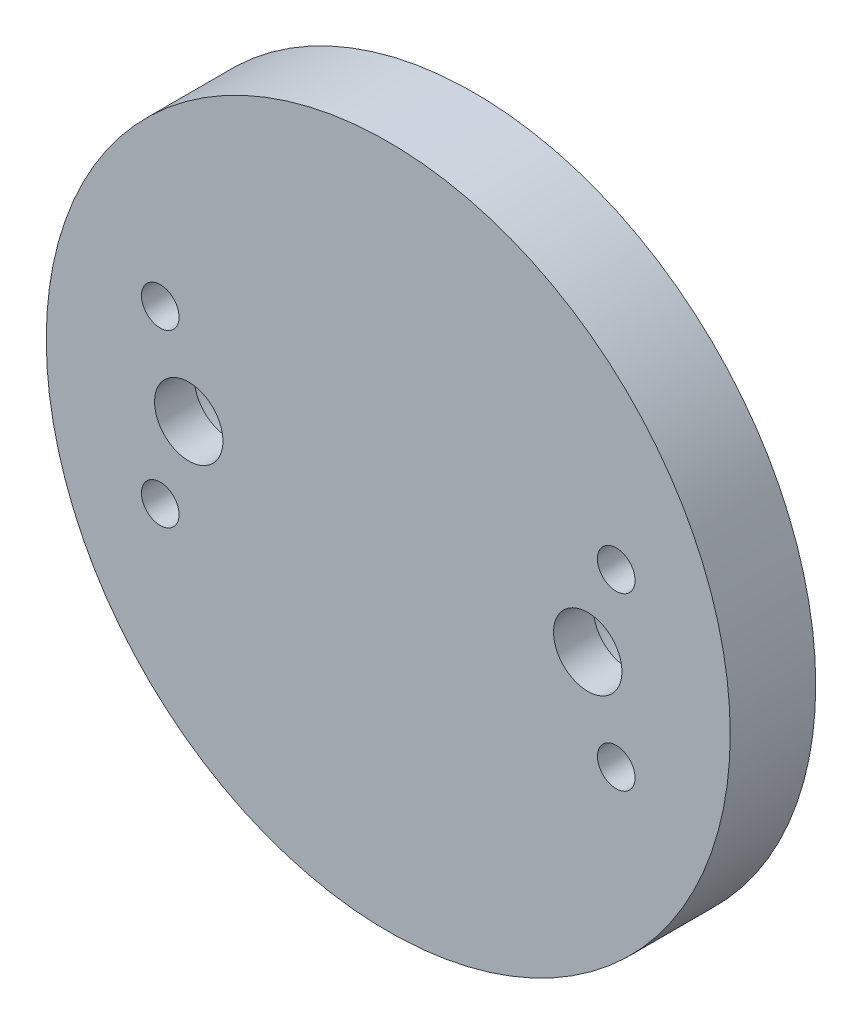
from build123d import *

# Parameters (mm, degrees)
SKETCH_1_R          = 60
EXTRUDE_1_DEPTH     = 15
SKETCH_2_R          = 6
CUT_EXTRUDE_1_DEPTH = 87.168439698
SKETCH_3_R          = 11
CUT_EXTRUDE_2_DEPTH = 8
SKETCH_5_R          = 3.3
CUT_EXTRUDE_4_DEPTH = 10
SKETCH_6_R          = 14
CUT_EXTRUDE_5_DEPTH = 7


with BuildPart() as part:
    # 草图1 → 凸台-拉伸1 (new body)
    with BuildSketch(Plane.XY):
        Circle(SKETCH_1_R)
    extrude(amount=EXTRUDE_1_DEPTH)

    # 草图2 → 切除-拉伸1 (cut, through all)
    with BuildSketch(Plane(origin=(0, 0, 0), x_dir=(-1, 0, 0), z_dir=(0, 0, -1))):
        with Locations((-35, 0)):
            Circle(SKETCH_2_R)
        with Locations((35, 0)):
            Circle(SKETCH_2_R)
    extrude(amount=-CUT_EXTRUDE_1_DEPTH, mode=Mode.SUBTRACT)

    # 草图3 → 切除-拉伸2 (cut)
    with BuildSketch(Plane(origin=(0, 0, 0), x_dir=(-1, 0, 0), z_dir=(0, 0, -1))):
        with Locations((35, 0)):
            Circle(SKETCH_3_R)
        with Locations((-35, 0)):
            Circle(SKETCH_3_R)
    extrude(amount=-CUT_EXTRUDE_2_DEPTH, mode=Mode.SUBTRACT)

    # 草图5 → 切除-拉伸4 (cut)
    with BuildSketch(Plane.XY.offset(15)):
        with Locations((40, 15)):
            Circle(SKETCH_5_R)
        with Locations((40, -15)):
            Circle(SKETCH_5_R)
        with Locations((-40, -15)):
            Circle(SKETCH_5_R)
        with Locations((-40, 15)):
            Circle(SKETCH_5_R)
    extrude(amount=-CUT_EXTRUDE_4_DEPTH, mode=Mode.SUBTRACT)

    # 草图6 → 切除-拉伸5 (cut)
    with BuildSketch(Plane(origin=(0, 0, 0), x_dir=(-1, 0, 0), z_dir=(0, 0, -1))):
        with Locations((35, 0)):
            Circle(SKETCH_6_R)
        with Locations((-35, 0)):
            Circle(SKETCH_6_R)
    extrude(amount=-CUT_EXTRUDE_5_DEPTH, mode=Mode.SUBTRACT)


solid = part.part
